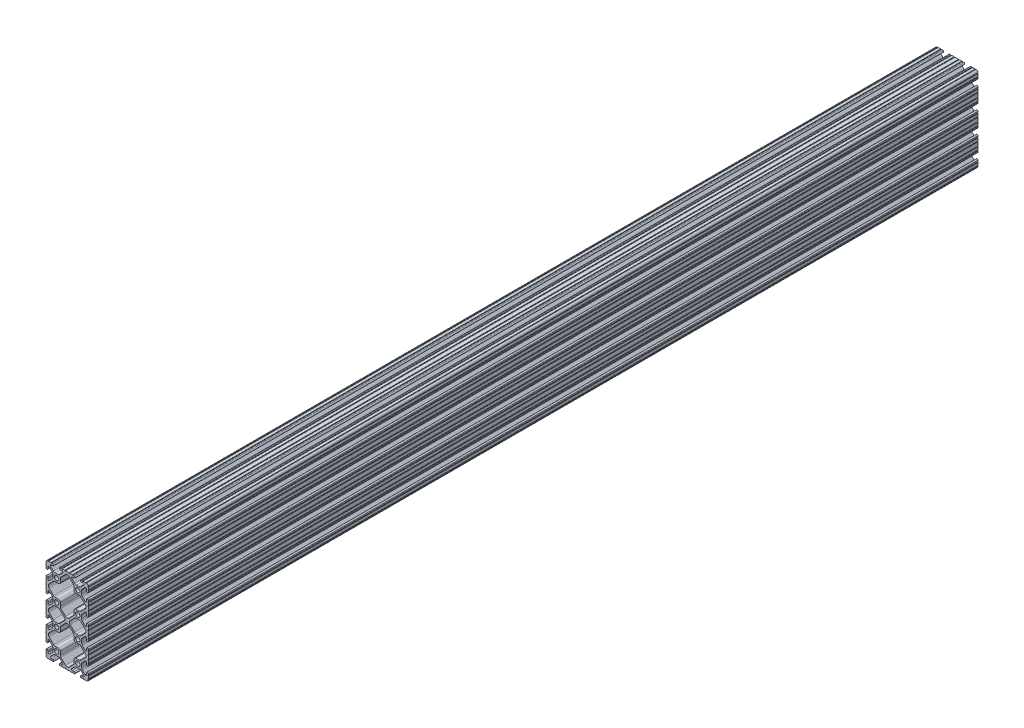
from build123d import *

# Parameters (mm, degrees)
SKETCH1_R      = 2.6035
EXTRUDE1_DEPTH = 1066.8


with BuildPart() as part:
    # Sketch1 → Extrude1 (new body)
    with BuildSketch(Plane.XY):
        with BuildLine():
            Line((-12.699984366, 40.2336), (-12.699984366, 35.9664))
            ThreePointArc((-12.699984366, 35.9664), (-12.192, 35.458392183), (-12.7, 34.9504))
            Line((-12.7, 34.9504), (-12.7, 32.004))
            ThreePointArc((-12.7, 32.004), (-12.192, 31.496), (-12.7, 30.988))
            Line((-12.7, 30.988), (-12.7, 29.7434))
            ThreePointArc((-12.7, 29.7434), (-11.5951, 28.6385), (-10.4902, 29.7434))
            Line((-10.4902, 29.7434), (-10.4902, 31.874256981))
            ThreePointArc((-10.4902, 31.874256981), (-9.863010627, 32.812916821), (-8.755786031, 32.592683991))
            Line((-8.755786031, 32.592683991), (-5.425756348, 29.262714761))
            ThreePointArc((-5.425756348, 29.262714761), (-4.737487999, 28.232663563), (-4.4958, 27.017630353))
            Line((-4.4958, 27.017630353), (-4.4958, 23.782369647))
            ThreePointArc((-4.4958, 23.782369647), (-4.737487999, 22.567336437), (-5.425756348, 21.537285239))
            Line((-5.425756348, 21.537285239), (-8.755786031, 18.207316009))
            ThreePointArc((-8.755786031, 18.207316009), (-9.863010627, 17.987083179), (-10.4902, 18.925743019))
            Line((-10.4902, 18.925743019), (-10.4902, 21.0566))
            ThreePointArc((-10.4902, 21.0566), (-11.5951, 22.1615), (-12.7, 21.0566))
            Line((-12.7, 21.0566), (-12.7, 19.812))
            ThreePointArc((-12.7, 19.812), (-12.192, 19.304), (-12.7, 18.796))
            Line((-12.7, 18.796), (-12.7, 15.8496))
            ThreePointArc((-12.7, 15.8496), (-12.192, 15.341607817), (-12.699984366, 14.8336))
            Line((-12.699984366, 14.8336), (-12.699984366, 10.5664))
            ThreePointArc((-12.699984366, 10.5664), (-12.192, 10.0584), (-12.699984366, 9.5504))
            Line((-12.699984366, 9.5504), (-12.699984366, 6.604))
            ThreePointArc((-12.699984366, 6.604), (-12.192, 6.095992183), (-12.7, 5.588))
            Line((-12.7, 5.588), (-12.7, 4.3434))
            ThreePointArc((-12.7, 4.3434), (-11.5951, 3.2385), (-10.4902, 4.3434))
            Line((-10.4902, 4.3434), (-10.4902, 6.474256981))
            ThreePointArc((-10.4902, 6.474256981), (-9.863010627, 7.412916821), (-8.755786031, 7.192683991))
            Line((-8.755786031, 7.192683991), (-5.425756348, 3.862714761))
            ThreePointArc((-5.425756348, 3.862714761), (-4.737487999, 2.832663563), (-4.4958, 1.617630353))
            Line((-4.4958, 1.617630353), (-4.4958, -1.617630353))
            ThreePointArc((-4.4958, -1.617630353), (-4.737487999, -2.832663563), (-5.425756348, -3.862714761))
            Line((-5.425756348, -3.862714761), (-8.755786031, -7.192683991))
            ThreePointArc((-8.755786031, -7.192683991), (-9.863010627, -7.412916821), (-10.4902, -6.474256981))
            Line((-10.4902, -6.474256981), (-10.4902, -4.3434))
            ThreePointArc((-10.4902, -4.3434), (-11.5951, -3.2385), (-12.7, -4.3434))
            Line((-12.7, -4.3434), (-12.7, -5.588))
            ThreePointArc((-12.7, -5.588), (-12.192, -6.096), (-12.7, -6.604))
            Line((-12.7, -6.604), (-12.7, -9.5504))
            ThreePointArc((-12.7, -9.5504), (-12.192000007, -10.058315768), (-12.699831537, -10.566399972))
            ThreePointArc((-12.699831537, -10.566399972), (-12.082506882, -12.082506882), (-10.566399972, -12.699831537))
            ThreePointArc((-10.566399972, -12.699831537), (-10.058315768, -12.192000007), (-9.5504, -12.7))
            Line((-9.5504, -12.7), (-6.604, -12.7))
            ThreePointArc((-6.604, -12.7), (-6.096, -12.192), (-5.588, -12.7))
            Line((-5.588, -12.7), (-4.3434, -12.7))
            ThreePointArc((-4.3434, -12.7), (-3.2385, -11.5951), (-4.3434, -10.4902))
            Line((-4.3434, -10.4902), (-6.474256981, -10.4902))
            ThreePointArc((-6.474256981, -10.4902), (-7.412916821, -9.863010627), (-7.192683991, -8.755786031))
            Line((-7.192683991, -8.755786031), (-3.862714761, -5.425756348))
            ThreePointArc((-3.862714761, -5.425756348), (-2.832663563, -4.737487999), (-1.617630353, -4.4958))
            Line((-1.617630353, -4.4958), (1.617630353, -4.4958))
            ThreePointArc((1.617630353, -4.4958), (2.832663563, -4.737487999), (3.862714761, -5.425756348))
            Line((3.862714761, -5.425756348), (7.192683991, -8.755786031))
            ThreePointArc((7.192683991, -8.755786031), (7.412916821, -9.863010627), (6.474256981, -10.4902))
            Line((6.474256981, -10.4902), (4.3434, -10.4902))
            ThreePointArc((4.3434, -10.4902), (3.2385, -11.5951), (4.3434, -12.7))
            Line((4.3434, -12.7), (5.588, -12.7))
            ThreePointArc((5.588, -12.7), (6.096, -12.192), (6.604, -12.7))
            Line((6.604, -12.7), (9.5504, -12.7))
            ThreePointArc((9.5504, -12.7), (10.0584, -12.192), (10.5664, -12.7))
            Line((10.5664, -12.7), (14.8336, -12.7))
            ThreePointArc((14.8336, -12.7), (15.3416, -12.192), (15.8496, -12.7))
            Line((15.8496, -12.7), (18.796, -12.7))
            ThreePointArc((18.796, -12.7), (19.304, -12.192), (19.812, -12.7))
            Line((19.812, -12.7), (21.0566, -12.7))
            ThreePointArc((21.0566, -12.7), (22.1615, -11.5951), (21.0566, -10.4902))
            Line((21.0566, -10.4902), (18.925743019, -10.4902))
            ThreePointArc((18.925743019, -10.4902), (17.987083179, -9.863010627), (18.207316009, -8.755786031))
            Line((18.207316009, -8.755786031), (21.537285239, -5.425756348))
            ThreePointArc((21.537285239, -5.425756348), (22.567336437, -4.737487999), (23.782369647, -4.4958))
            Line((23.782369647, -4.4958), (27.017630353, -4.4958))
            ThreePointArc((27.017630353, -4.4958), (28.232663563, -4.737487999), (29.262714761, -5.425756348))
            Line((29.262714761, -5.425756348), (32.592683991, -8.755786031))
            ThreePointArc((32.592683991, -8.755786031), (32.812916821, -9.863010627), (31.874256981, -10.4902))
            Line((31.874256981, -10.4902), (29.7434, -10.4902))
            ThreePointArc((29.7434, -10.4902), (28.6385, -11.5951), (29.7434, -12.7))
            Line((29.7434, -12.7), (30.988, -12.7))
            ThreePointArc((30.988, -12.7), (31.496, -12.192), (32.004, -12.7))
            Line((32.004, -12.7), (34.9504, -12.7))
            ThreePointArc((34.9504, -12.7), (35.458315768, -12.192000007), (35.966399972, -12.699831537))
            ThreePointArc((35.966399972, -12.699831537), (37.482506882, -12.082506882), (38.099831537, -10.566399972))
            ThreePointArc((38.099831537, -10.566399972), (37.592000007, -10.058315768), (38.1, -9.5504))
            Line((38.1, -9.5504), (38.1, -6.604))
            ThreePointArc((38.1, -6.604), (37.592, -6.096), (38.1, -5.588))
            Line((38.1, -5.588), (38.1, -4.3434))
            ThreePointArc((38.1, -4.3434), (36.9951, -3.2385), (35.8902, -4.3434))
            Line((35.8902, -4.3434), (35.8902, -6.474256981))
            ThreePointArc((35.8902, -6.474256981), (35.263010627, -7.412916821), (34.155786031, -7.192683991))
            Line((34.155786031, -7.192683991), (30.825756348, -3.862714761))
            ThreePointArc((30.825756348, -3.862714761), (30.137487999, -2.832663563), (29.8958, -1.617630353))
            Line((29.8958, -1.617630353), (29.8958, 1.617630353))
            ThreePointArc((29.8958, 1.617630353), (30.137487999, 2.832663563), (30.825756348, 3.862714761))
            Line((30.825756348, 3.862714761), (34.155786031, 7.192683991))
            ThreePointArc((34.155786031, 7.192683991), (35.263010627, 7.412916821), (35.8902, 6.474256981))
            Line((35.8902, 6.474256981), (35.8902, 4.3434))
            ThreePointArc((35.8902, 4.3434), (36.9951, 3.2385), (38.1, 4.3434))
            Line((38.1, 4.3434), (38.1, 5.588))
            ThreePointArc((38.1, 5.588), (37.592, 6.096), (38.1, 6.604))
            Line((38.1, 6.604), (38.1, 9.5504))
            ThreePointArc((38.1, 9.5504), (37.592, 10.058392183), (38.099984366, 10.5664))
            Line((38.099984366, 10.5664), (38.099984366, 14.8336))
            ThreePointArc((38.099984366, 14.8336), (37.592, 15.3416), (38.099984366, 15.8496))
            Line((38.099984366, 15.8496), (38.099984366, 18.796))
            ThreePointArc((38.099984366, 18.796), (37.592, 19.304007817), (38.1, 19.812))
            Line((38.1, 19.812), (38.1, 21.0566))
            ThreePointArc((38.1, 21.0566), (36.9951, 22.1615), (35.8902, 21.0566))
            Line((35.8902, 21.0566), (35.8902, 18.925743019))
            ThreePointArc((35.8902, 18.925743019), (35.263010627, 17.987083179), (34.155786031, 18.207316009))
            Line((34.155786031, 18.207316009), (30.825756348, 21.537285239))
            ThreePointArc((30.825756348, 21.537285239), (30.137487999, 22.567336437), (29.8958, 23.782369647))
            Line((29.8958, 23.782369647), (29.8958, 27.017630353))
            ThreePointArc((29.8958, 27.017630353), (30.137487999, 28.232663563), (30.825756348, 29.262714761))
            Line((30.825756348, 29.262714761), (34.155786031, 32.592683991))
            ThreePointArc((34.155786031, 32.592683991), (35.263010627, 32.812916821), (35.8902, 31.874256981))
            Line((35.8902, 31.874256981), (35.8902, 29.7434))
            ThreePointArc((35.8902, 29.7434), (36.9951, 28.6385), (38.1, 29.7434))
            Line((38.1, 29.7434), (38.1, 30.988))
            ThreePointArc((38.1, 30.988), (37.592, 31.495992183), (38.099984366, 32.004))
            Line((38.099984366, 32.004), (38.099984366, 34.9504))
            ThreePointArc((38.099984366, 34.9504), (37.592, 35.4584), (38.099984366, 35.9664))
            Line((38.099984366, 35.9664), (38.099984366, 40.2336))
            ThreePointArc((38.099984366, 40.2336), (37.592, 40.7416), (38.099984366, 41.2496))
            Line((38.099984366, 41.2496), (38.099984366, 44.196))
            ThreePointArc((38.099984366, 44.196), (37.592, 44.704007817), (38.1, 45.212))
            Line((38.1, 45.212), (38.1, 46.4566))
            ThreePointArc((38.1, 46.4566), (36.9951, 47.5615), (35.8902, 46.4566))
            Line((35.8902, 46.4566), (35.8902, 44.325743019))
            ThreePointArc((35.8902, 44.325743019), (35.263010627, 43.387083179), (34.155786031, 43.607316009))
            Line((34.155786031, 43.607316009), (30.825756348, 46.937285239))
            ThreePointArc((30.825756348, 46.937285239), (30.137487999, 47.967336437), (29.8958, 49.182369647))
            Line((29.8958, 49.182369647), (29.8958, 52.417630353))
            ThreePointArc((29.8958, 52.417630353), (30.137487999, 53.632663563), (30.825756348, 54.662714761))
            Line((30.825756348, 54.662714761), (34.155786031, 57.992683991))
            ThreePointArc((34.155786031, 57.992683991), (35.263010627, 58.212916821), (35.8902, 57.274256981))
            Line((35.8902, 57.274256981), (35.8902, 55.1434))
            ThreePointArc((35.8902, 55.1434), (36.9951, 54.0385), (38.1, 55.1434))
            Line((38.1, 55.1434), (38.1, 56.388))
            ThreePointArc((38.1, 56.388), (37.592, 56.896), (38.1, 57.404))
            Line((38.1, 57.404), (38.1, 60.3504))
            ThreePointArc((38.1, 60.3504), (37.592, 60.858392183), (38.099984366, 61.3664))
            Line((38.099984366, 61.3664), (38.099984366, 65.6336))
            ThreePointArc((38.099984366, 65.6336), (37.592, 66.141607817), (38.1, 66.6496))
            Line((38.1, 66.6496), (38.1, 69.596))
            ThreePointArc((38.1, 69.596), (37.592, 70.104), (38.1, 70.612))
            Line((38.1, 70.612), (38.1, 71.8566))
            ThreePointArc((38.1, 71.8566), (36.9951, 72.9615), (35.8902, 71.8566))
            Line((35.8902, 71.8566), (35.8902, 69.725743019))
            ThreePointArc((35.8902, 69.725743019), (35.263010627, 68.787083179), (34.155786031, 69.007316009))
            Line((34.155786031, 69.007316009), (30.825756348, 72.337285239))
            ThreePointArc((30.825756348, 72.337285239), (30.137487999, 73.367336437), (29.8958, 74.582369647))
            Line((29.8958, 74.582369647), (29.8958, 77.817630353))
            ThreePointArc((29.8958, 77.817630353), (30.137487999, 79.032663563), (30.825756348, 80.062714761))
            Line((30.825756348, 80.062714761), (34.155786031, 83.392683991))
            ThreePointArc((34.155786031, 83.392683991), (35.263010627, 83.612916821), (35.8902, 82.674256981))
            Line((35.8902, 82.674256981), (35.8902, 80.5434))
            ThreePointArc((35.8902, 80.5434), (36.9951, 79.4385), (38.1, 80.5434))
            Line((38.1, 80.5434), (38.1, 81.788))
            ThreePointArc((38.1, 81.788), (37.592, 82.296), (38.1, 82.804))
            Line((38.1, 82.804), (38.1, 85.7504))
            ThreePointArc((38.1, 85.7504), (37.592000007, 86.258315768), (38.099831537, 86.766399972))
            ThreePointArc((38.099831537, 86.766399972), (37.482506882, 88.282506882), (35.966399972, 88.899831537))
            ThreePointArc((35.966399972, 88.899831537), (35.458315768, 88.392000007), (34.9504, 88.9))
            Line((34.9504, 88.9), (32.004, 88.9))
            ThreePointArc((32.004, 88.9), (31.496, 88.392), (30.988, 88.9))
            Line((30.988, 88.9), (29.7434, 88.9))
            ThreePointArc((29.7434, 88.9), (28.6385, 87.7951), (29.7434, 86.6902))
            Line((29.7434, 86.6902), (31.874256981, 86.6902))
            ThreePointArc((31.874256981, 86.6902), (32.812916821, 86.063010627), (32.592683991, 84.955786031))
            Line((32.592683991, 84.955786031), (29.262714761, 81.625756348))
            ThreePointArc((29.262714761, 81.625756348), (28.232663563, 80.937487999), (27.017630353, 80.6958))
            Line((27.017630353, 80.6958), (23.782369647, 80.6958))
            ThreePointArc((23.782369647, 80.6958), (22.567336437, 80.937487999), (21.537285239, 81.625756348))
            Line((21.537285239, 81.625756348), (18.207316009, 84.955786031))
            ThreePointArc((18.207316009, 84.955786031), (17.987083179, 86.063010627), (18.925743019, 86.6902))
            Line((18.925743019, 86.6902), (21.0566, 86.6902))
            ThreePointArc((21.0566, 86.6902), (22.1615, 87.7951), (21.0566, 88.9))
            Line((21.0566, 88.9), (19.812, 88.9))
            ThreePointArc((19.812, 88.9), (19.304, 88.392), (18.796, 88.9))
            Line((18.796, 88.9), (15.8496, 88.9))
            ThreePointArc((15.8496, 88.9), (15.3416, 88.392), (14.8336, 88.9))
            Line((14.8336, 88.9), (10.5664, 88.9))
            ThreePointArc((10.5664, 88.9), (10.0584, 88.392), (9.5504, 88.9))
            Line((9.5504, 88.9), (6.604, 88.9))
            ThreePointArc((6.604, 88.9), (6.096, 88.392), (5.588, 88.9))
            Line((5.588, 88.9), (4.3434, 88.9))
            ThreePointArc((4.3434, 88.9), (3.2385, 87.7951), (4.3434, 86.6902))
            Line((4.3434, 86.6902), (6.474256981, 86.6902))
            ThreePointArc((6.474256981, 86.6902), (7.412916821, 86.063010627), (7.192683991, 84.955786031))
            Line((7.192683991, 84.955786031), (3.862714761, 81.625756348))
            ThreePointArc((3.862714761, 81.625756348), (2.832663563, 80.937487999), (1.617630353, 80.6958))
            Line((1.617630353, 80.6958), (-1.617630353, 80.6958))
            ThreePointArc((-1.617630353, 80.6958), (-2.832663563, 80.937487999), (-3.862714761, 81.625756348))
            Line((-3.862714761, 81.625756348), (-7.192683991, 84.955786031))
            ThreePointArc((-7.192683991, 84.955786031), (-7.412916821, 86.063010627), (-6.474256981, 86.6902))
            Line((-6.474256981, 86.6902), (-4.3434, 86.6902))
            ThreePointArc((-4.3434, 86.6902), (-3.2385, 87.7951), (-4.3434, 88.9))
            Line((-4.3434, 88.9), (-5.588, 88.9))
            ThreePointArc((-5.588, 88.9), (-6.096, 88.392), (-6.604, 88.9))
            Line((-6.604, 88.9), (-9.5504, 88.9))
            ThreePointArc((-9.5504, 88.9), (-10.058315768, 88.392000007), (-10.566399972, 88.899831537))
            ThreePointArc((-10.566399972, 88.899831537), (-12.082506882, 88.282506882), (-12.699831537, 86.766399972))
            ThreePointArc((-12.699831537, 86.766399972), (-12.192000007, 86.258315768), (-12.7, 85.7504))
            Line((-12.7, 85.7504), (-12.7, 82.804))
            ThreePointArc((-12.7, 82.804), (-12.192, 82.296), (-12.7, 81.788))
            Line((-12.7, 81.788), (-12.7, 80.5434))
            ThreePointArc((-12.7, 80.5434), (-11.5951, 79.4385), (-10.4902, 80.5434))
            Line((-10.4902, 80.5434), (-10.4902, 82.674256981))
            ThreePointArc((-10.4902, 82.674256981), (-9.863010627, 83.612916821), (-8.755786031, 83.392683991))
            Line((-8.755786031, 83.392683991), (-5.425756348, 80.062714761))
            ThreePointArc((-5.425756348, 80.062714761), (-4.737487999, 79.032663563), (-4.4958, 77.817630353))
            Line((-4.4958, 77.817630353), (-4.4958, 74.582369647))
            ThreePointArc((-4.4958, 74.582369647), (-4.737487999, 73.367336437), (-5.425756348, 72.337285239))
            Line((-5.425756348, 72.337285239), (-8.755786031, 69.007316009))
            ThreePointArc((-8.755786031, 69.007316009), (-9.863010627, 68.787083179), (-10.4902, 69.725743019))
            Line((-10.4902, 69.725743019), (-10.4902, 71.8566))
            ThreePointArc((-10.4902, 71.8566), (-11.5951, 72.9615), (-12.7, 71.8566))
            Line((-12.7, 71.8566), (-12.7, 70.612))
            ThreePointArc((-12.7, 70.612), (-12.192, 70.104), (-12.7, 69.596))
            Line((-12.7, 69.596), (-12.7, 66.6496))
            ThreePointArc((-12.7, 66.6496), (-12.192, 66.141607817), (-12.699984366, 65.6336))
            Line((-12.699984366, 65.6336), (-12.699984366, 61.3664))
            ThreePointArc((-12.699984366, 61.3664), (-12.192, 60.858392183), (-12.7, 60.3504))
            Line((-12.7, 60.3504), (-12.7, 57.404))
            ThreePointArc((-12.7, 57.404), (-12.192, 56.896), (-12.7, 56.388))
            Line((-12.7, 56.388), (-12.7, 55.1434))
            ThreePointArc((-12.7, 55.1434), (-11.5951, 54.0385), (-10.4902, 55.1434))
            Line((-10.4902, 55.1434), (-10.4902, 57.274256981))
            ThreePointArc((-10.4902, 57.274256981), (-9.863010627, 58.212916821), (-8.755786031, 57.992683991))
            Line((-8.755786031, 57.992683991), (-5.425756348, 54.662714761))
            ThreePointArc((-5.425756348, 54.662714761), (-4.737487999, 53.632663563), (-4.4958, 52.417630353))
            Line((-4.4958, 52.417630353), (-4.4958, 49.182369647))
            ThreePointArc((-4.4958, 49.182369647), (-4.737487999, 47.967336437), (-5.425756348, 46.937285239))
            Line((-5.425756348, 46.937285239), (-8.755786031, 43.607316009))
            ThreePointArc((-8.755786031, 43.607316009), (-9.863010627, 43.387083179), (-10.4902, 44.325743019))
            Line((-10.4902, 44.325743019), (-10.4902, 46.4566))
            ThreePointArc((-10.4902, 46.4566), (-11.5951, 47.5615), (-12.7, 46.4566))
            Line((-12.7, 46.4566), (-12.7, 45.212))
            ThreePointArc((-12.7, 45.212), (-12.192, 44.704), (-12.7, 44.196))
            Line((-12.7, 44.196), (-12.7, 41.2496))
            ThreePointArc((-12.7, 41.2496), (-12.192, 40.741607817), (-12.699984366, 40.2336))
        make_face()
        with Locations((25.4, 76.2)):
            Circle(SKETCH1_R, mode=Mode.SUBTRACT)
        with Locations((0, 76.2)):
            Circle(SKETCH1_R, mode=Mode.SUBTRACT)
        with Locations((25.4, 50.8)):
            Circle(SKETCH1_R, mode=Mode.SUBTRACT)
        with Locations((0, 50.8)):
            Circle(SKETCH1_R, mode=Mode.SUBTRACT)
        with Locations((25.4, 0)):
            Circle(SKETCH1_R, mode=Mode.SUBTRACT)
        Circle(SKETCH1_R, mode=Mode.SUBTRACT)
        with Locations((25.4, 25.4)):
            Circle(SKETCH1_R, mode=Mode.SUBTRACT)
        with Locations((0, 25.4)):
            Circle(SKETCH1_R, mode=Mode.SUBTRACT)
        with BuildLine():
            Line((2.286, 55.2958), (-2.018378203, 55.2958))
            ThreePointArc((-2.018378203, 55.2958), (-2.864022786, 55.464007171), (-3.580928584, 55.943021252))
            Line((-3.580928584, 55.943021252), (-9.072529371, 61.434522344))
            ThreePointArc((-9.072529371, 61.434522344), (-9.928089211, 63.5), (-9.072529371, 65.565477656))
            Line((-9.072529371, 65.565477656), (-3.580928584, 71.056978748))
            ThreePointArc((-3.580928584, 71.056978748), (-2.864022786, 71.535992829), (-2.018378203, 71.7042))
            Line((-2.018378203, 71.7042), (2.286, 71.7042))
            ThreePointArc((2.286, 71.7042), (3.848564565, 72.351435435), (4.4958, 73.914))
            Line((4.4958, 73.914), (4.4958, 78.218378203))
            ThreePointArc((4.4958, 78.218378203), (4.664007171, 79.064022786), (5.143021252, 79.780928584))
            Line((5.143021252, 79.780928584), (10.634522344, 85.272529371))
            ThreePointArc((10.634522344, 85.272529371), (12.7, 86.128089211), (14.765477656, 85.272529371))
            Line((14.765477656, 85.272529371), (20.256978748, 79.780928584))
            ThreePointArc((20.256978748, 79.780928584), (20.735992829, 79.064022786), (20.9042, 78.218378203))
            Line((20.9042, 78.218378203), (20.9042, 73.914))
            ThreePointArc((20.9042, 73.914), (21.551435435, 72.351435435), (23.114, 71.7042))
            Line((23.114, 71.7042), (27.418378203, 71.7042))
            ThreePointArc((27.418378203, 71.7042), (28.264022786, 71.535992829), (28.980928584, 71.056978748))
            Line((28.980928584, 71.056978748), (34.472529371, 65.565477656))
            ThreePointArc((34.472529371, 65.565477656), (35.328089211, 63.5), (34.472529371, 61.434522344))
            Line((34.472529371, 61.434522344), (28.980928584, 55.943021252))
            ThreePointArc((28.980928584, 55.943021252), (28.264022786, 55.464007171), (27.418378203, 55.2958))
            Line((27.418378203, 55.2958), (23.114, 55.2958))
            ThreePointArc((23.114, 55.2958), (21.551435435, 54.648564565), (20.9042, 53.086))
            Line((20.9042, 53.086), (20.9042, 48.781621797))
            ThreePointArc((20.9042, 48.781621797), (20.735992829, 47.935977214), (20.256978748, 47.219071416))
            Line((20.256978748, 47.219071416), (14.765477656, 41.727470629))
            ThreePointArc((14.765477656, 41.727470629), (12.7, 40.871910789), (10.634522344, 41.727470629))
            Line((10.634522344, 41.727470629), (5.143021252, 47.219071416))
            ThreePointArc((5.143021252, 47.219071416), (4.664007171, 47.935977214), (4.4958, 48.781621797))
            Line((4.4958, 48.781621797), (4.4958, 53.086))
            ThreePointArc((4.4958, 53.086), (3.848564565, 54.648564565), (2.286, 55.2958))
        make_face(mode=Mode.SUBTRACT)
        with BuildLine():
            Line((4.4958, 23.114), (4.4958, 27.418378203))
            ThreePointArc((4.4958, 27.418378203), (4.664007171, 28.264022786), (5.143021252, 28.980928584))
            Line((5.143021252, 28.980928584), (10.634522344, 34.472529371))
            ThreePointArc((10.634522344, 34.472529371), (12.7, 35.328089211), (14.765477656, 34.472529371))
            Line((14.765477656, 34.472529371), (20.256978748, 28.980928584))
            ThreePointArc((20.256978748, 28.980928584), (20.735992829, 28.264022786), (20.9042, 27.418378203))
            Line((20.9042, 27.418378203), (20.9042, 23.114))
            ThreePointArc((20.9042, 23.114), (21.551435435, 21.551435435), (23.114, 20.9042))
            Line((23.114, 20.9042), (27.418378203, 20.9042))
            ThreePointArc((27.418378203, 20.9042), (28.264022786, 20.735992829), (28.980928584, 20.256978748))
            Line((28.980928584, 20.256978748), (34.472529371, 14.765477656))
            ThreePointArc((34.472529371, 14.765477656), (35.328089211, 12.7), (34.472529371, 10.634522344))
            Line((34.472529371, 10.634522344), (28.980928584, 5.143021252))
            ThreePointArc((28.980928584, 5.143021252), (28.264022786, 4.664007171), (27.418378203, 4.4958))
            Line((27.418378203, 4.4958), (23.114, 4.4958))
            ThreePointArc((23.114, 4.4958), (21.551435435, 3.848564565), (20.9042, 2.286))
            Line((20.9042, 2.286), (20.9042, -2.018378203))
            ThreePointArc((20.9042, -2.018378203), (20.735992829, -2.864022786), (20.256978748, -3.580928584))
            Line((20.256978748, -3.580928584), (14.765477656, -9.072529371))
            ThreePointArc((14.765477656, -9.072529371), (12.7, -9.928089211), (10.634522344, -9.072529371))
            Line((10.634522344, -9.072529371), (5.143021252, -3.580928584))
            ThreePointArc((5.143021252, -3.580928584), (4.664007171, -2.864022786), (4.4958, -2.018378203))
            Line((4.4958, -2.018378203), (4.4958, 2.286))
            ThreePointArc((4.4958, 2.286), (3.848564565, 3.848564565), (2.286, 4.4958))
            Line((2.286, 4.4958), (-2.018378203, 4.4958))
            ThreePointArc((-2.018378203, 4.4958), (-2.864022786, 4.664007171), (-3.580928584, 5.143021252))
            Line((-3.580928584, 5.143021252), (-9.072529371, 10.634522344))
            ThreePointArc((-9.072529371, 10.634522344), (-9.928089211, 12.7), (-9.072529371, 14.765477656))
            Line((-9.072529371, 14.765477656), (-3.580928584, 20.256978748))
            ThreePointArc((-3.580928584, 20.256978748), (-2.864022786, 20.735992829), (-2.018378203, 20.9042))
            Line((-2.018378203, 20.9042), (2.286, 20.9042))
            ThreePointArc((2.286, 20.9042), (3.848564565, 21.551435435), (4.4958, 23.114))
        make_face(mode=Mode.SUBTRACT)
        with BuildLine():
            Line((27.018584404, 29.8958), (23.782369647, 29.8958))
            ThreePointArc((23.782369647, 29.8958), (22.567336437, 30.137487999), (21.537285239, 30.825756348))
            Line((21.537285239, 30.825756348), (16.328576307, 36.03455984))
            ThreePointArc((16.328576307, 36.03455984), (15.473053963, 38.1), (16.328576307, 40.16544016))
            Line((16.328576307, 40.16544016), (21.537285239, 45.374243652))
            ThreePointArc((21.537285239, 45.374243652), (22.567336437, 46.062512001), (23.782369647, 46.3042))
            Line((23.782369647, 46.3042), (27.018584404, 46.3042))
            ThreePointArc((27.018584404, 46.3042), (28.233590989, 46.06252303), (29.263628056, 45.374284409))
            Line((29.263628056, 45.374284409), (34.472529371, 40.165477656))
            ThreePointArc((34.472529371, 40.165477656), (35.328089211, 38.1), (34.472529371, 36.034522344))
            Line((34.472529371, 36.034522344), (29.263628056, 30.825715591))
            ThreePointArc((29.263628056, 30.825715591), (28.233590989, 30.13747697), (27.018584404, 29.8958))
        make_face(mode=Mode.SUBTRACT)
        with BuildLine():
            Line((1.617630353, 29.8958), (-1.618584404, 29.8958))
            ThreePointArc((-1.618584404, 29.8958), (-2.833590989, 30.13747697), (-3.863628056, 30.825715591))
            Line((-3.863628056, 30.825715591), (-9.072529371, 36.034522344))
            ThreePointArc((-9.072529371, 36.034522344), (-9.928089211, 38.1), (-9.072529371, 40.165477656))
            Line((-9.072529371, 40.165477656), (-3.863628056, 45.374284409))
            ThreePointArc((-3.863628056, 45.374284409), (-2.833590989, 46.06252303), (-1.618584404, 46.3042))
            Line((-1.618584404, 46.3042), (1.617630353, 46.3042))
            ThreePointArc((1.617630353, 46.3042), (2.832663563, 46.062512001), (3.862714761, 45.374243652))
            Line((3.862714761, 45.374243652), (9.071423693, 40.16544016))
            ThreePointArc((9.071423693, 40.16544016), (9.926946037, 38.1), (9.071423693, 36.03455984))
            Line((9.071423693, 36.03455984), (3.862714761, 30.825756348))
            ThreePointArc((3.862714761, 30.825756348), (2.832663563, 30.137487999), (1.617630353, 29.8958))
        make_face(mode=Mode.SUBTRACT)
    extrude(amount=-EXTRUDE1_DEPTH)


solid = part.part
